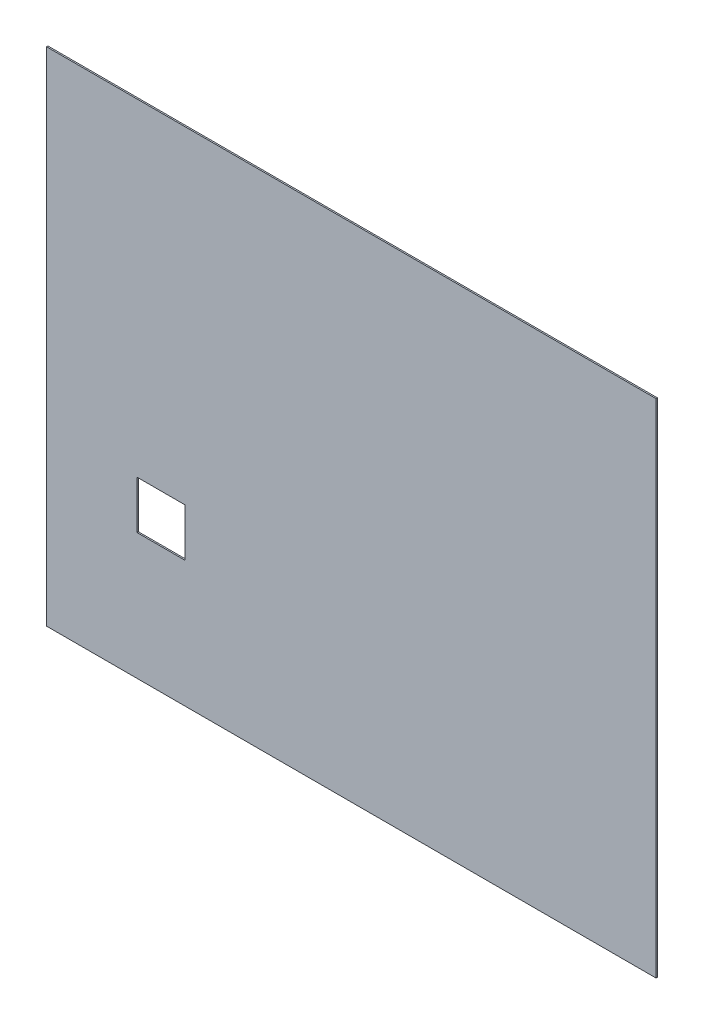
from build123d import *

# Parameters (mm, degrees)
SKETCH1_W           = 431.8
SKETCH1_H           = 355.6
BOSS_EXTRUDE1_DEPTH = 0.9906
SKETCH2_W           = 34
SKETCH2_H           = 34
CUT_EXTRUDE1_DEPTH  = 280.690241675
SKETCH3_R           = 16.811779192
SKETCH3_R_2         = 17.94039836
SKETCH3_R_3         = 15.918471064
BOSS_EXTRUDE2_DEPTH = 7.62


with BuildPart() as part:
    # Sketch1 → Boss-Extrude1 (new body)
    with BuildSketch(Plane.XY):
        Rectangle(SKETCH1_W, SKETCH1_H)
    extrude(amount=BOSS_EXTRUDE1_DEPTH)

    # Sketch2 → Cut-Extrude1 (cut, through all)
    with BuildSketch(Plane.XY.offset(0.9906)):
        with Locations((-134.9, -71.3)):
            Rectangle(SKETCH2_W, SKETCH2_H)
    extrude(amount=-CUT_EXTRUDE1_DEPTH, mode=Mode.SUBTRACT)

    # Sketch3 → Boss-Extrude2 (add)
    with BuildSketch(Plane(origin=(0, 0, 0), x_dir=(-1, 0, 0), z_dir=(0, 0, -1))):
        with Locations(Location((-152.604411187, 148.581420283, 0), (0, 0, 180))):
            Circle(SKETCH3_R)
        with Locations(Location((178.932328772, 148.581420283, 0), (0, 0, 180))):
            Circle(SKETCH3_R_2)
        with Locations(Location((-176.007004595, -138.100348975, 0), (0, 0, 180))):
            Circle(SKETCH3_R)
        with Locations(Location((178.932328772, -142.488335239, 0), (0, 0, 180))):
            Circle(SKETCH3_R_3)
    extrude(amount=BOSS_EXTRUDE2_DEPTH)


solid = part.part
